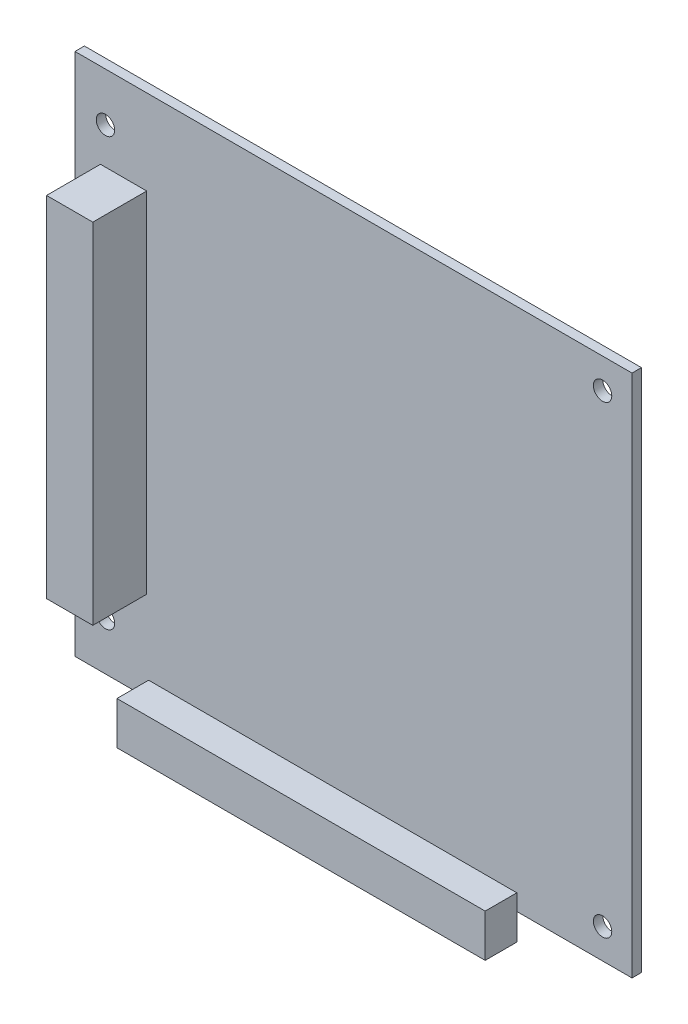
from build123d import *

# Parameters (mm, degrees)
SKETCH1_W               = 96.0628
SKETCH1_H               = 90.3478
PCB_DEPTH               = 1.6256
SKETCH5_R               = 1.5875
PCB_HOLES_DEPTH         = 66.957101229
SKETCH2_W               = 7.9756
SKETCH2_H               = 60.2234
PCI_104_CONNECTOR_DEPTH = 9.2964
SKETCH6_W               = 63.5
SKETCH6_H               = 7.366
PCB_EDGE_CONNS_DEPTH    = 5.461


with BuildPart() as part:
    # Sketch1 → PCB (new body)
    with BuildSketch(Plane.XY):
        Rectangle(SKETCH1_W, SKETCH1_H)
    extrude(amount=PCB_DEPTH)

    # Sketch5 → PCB_Holes (cut, through all)
    with BuildSketch(Plane.XY.offset(1.6256)):
        with Locations((-42.7736, 36.83)):
            Circle(SKETCH5_R)
        with Locations((42.9514, 40.005)):
            Circle(SKETCH5_R)
        with Locations((42.9514, -40.005)):
            Circle(SKETCH5_R)
        with Locations((-42.7736, -36.83)):
            Circle(SKETCH5_R)
    extrude(amount=-PCB_HOLES_DEPTH, mode=Mode.SUBTRACT)

    # Sketch2 → PCI-104_Connector (add)
    with BuildSketch(Plane.XY.offset(1.6256)):
        with Locations((-39.6494, 0.4064)):
            Rectangle(SKETCH2_W, SKETCH2_H)
    extrude(amount=PCI_104_CONNECTOR_DEPTH)

    # Sketch6 → PCB_Edge_Conns (add)
    with BuildSketch(Plane.XY.offset(1.6256)):
        with Locations((-3.5814, -46.0629)):
            Rectangle(SKETCH6_W, SKETCH6_H)
    extrude(amount=PCB_EDGE_CONNS_DEPTH)


solid = part.part
